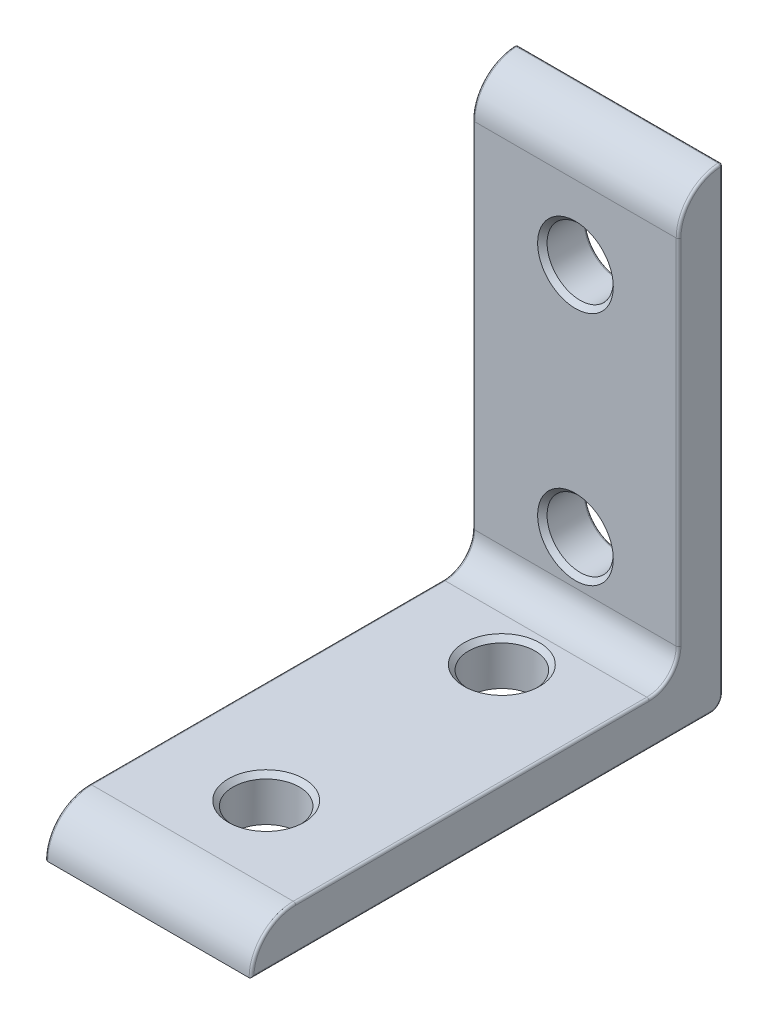
from build123d import *

# Parameters (mm, degrees)
BOSS_EXTRUDE1_START = 11.1125
BOSS_EXTRUDE1_DEPTH = 22.225
FILLET1_R           = 1.2715875
SKETCH4_R           = 3.5687
CUT_EXTRUDE1_DEPTH  = 54.741037043
SKETCH6_R           = 3.5687
CUT_EXTRUDE3_DEPTH  = 7.874
CHAMFER1_SIZE       = 0.508
FILLET2_R           = 0.254


with BuildPart() as part:
    # Sketch3 → Boss-Extrude1 (new body)
    with BuildSketch(Plane(origin=(0, 0, 0), x_dir=(0, 0, -1), z_dir=(1, 0, 0)).offset(BOSS_EXTRUDE1_START)):
        with BuildLine():
            Line((-3.175, -20.6375), (-41.275, -20.6375))
            ThreePointArc((-41.275, -20.6375), (-44.642596045, -22.032403955), (-46.0375, -25.4))
            Line((-46.0375, -25.4), (4.7625, -25.4))
            Line((4.7625, -25.4), (4.7625, 25.4))
            ThreePointArc((4.7625, 25.4), (1.394903955, 24.005096045), (0, 20.6375))
            Line((0, 20.6375), (0, -17.4625))
            ThreePointArc((0, -17.4625), (-0.92993597, -19.70756403), (-3.175, -20.6375))
        make_face()
    extrude(amount=-BOSS_EXTRUDE1_DEPTH)

    # Fillet1
    fillet1_edges = [part.edges().sort_by_distance(p)[0] for p in [
        (0, -25.4, -4.7625),
    ]]
    fillet(fillet1_edges, radius=FILLET1_R)

    # Sketch4 → Cut-Extrude1 (cut, through all)
    with BuildSketch(Plane.XY):
        with Locations((0, 12.7)):
            Circle(SKETCH4_R)
        with Locations(Location((0, -12.7, 0), (0, 0, 180))):
            Circle(SKETCH4_R)
    extrude(amount=-CUT_EXTRUDE1_DEPTH, mode=Mode.SUBTRACT)

    # Sketch6 → Cut-Extrude3 (cut)
    with BuildSketch(Plane(origin=(0, -20.6375, 0), x_dir=(1, 0, 0), z_dir=(0, 1, 0))):
        with Locations(Location((0, -7.9375, 0), (0, 0, 270))):
            Circle(SKETCH6_R)
        with Locations(Location((0, -33.3375, 0), (0, 0, 270))):
            Circle(SKETCH6_R)
    extrude(amount=-CUT_EXTRUDE3_DEPTH, mode=Mode.SUBTRACT)

    # Chamfer1
    chamfer1_edges = [part.edges().sort_by_distance(p)[0] for p in [
        (-3.5687, 12.7, 0),
        (3.5687, -12.7, 0),
        (0, -20.6375, 4.3688),
        (0, -20.6375, 29.7688),
    ]]
    chamfer(chamfer1_edges, length=CHAMFER1_SIZE)

    # Fillet2
    fillet2_edges = [part.edges().sort_by_distance(p)[0] for p in [
        (0, 25.4, -4.7625),
        (-11.1125, 24.005096045, -1.394903955),
        (-11.1125, 1.5875, 0),
        (-11.1125, -19.70756403, 0.92993597),
        (-11.1125, -20.6375, 22.225),
        (11.1125, 0.63579375, -4.7625),
        (11.1125, -25.027560644, -4.390060644),
        (-11.1125, 0.63579375, -4.7625),
        (-11.1125, -25.027560644, -4.390060644),
        (-3.5687, 12.7, -4.7625),
        (3.5687, -12.7, -4.7625),
        (-11.1125, -22.032403955, 44.642596045),
        (11.1125, -20.6375, 22.225),
        (-11.1125, -25.4, 21.27329375),
        (11.1125, -19.70756403, 0.92993597),
        (11.1125, 1.5875, 0),
        (11.1125, 24.005096045, -1.394903955),
        (11.1125, -25.4, 21.27329375),
        (11.1125, -22.032403955, 44.642596045),
    ]]
    fillet(fillet2_edges, radius=FILLET2_R)


solid = part.part
